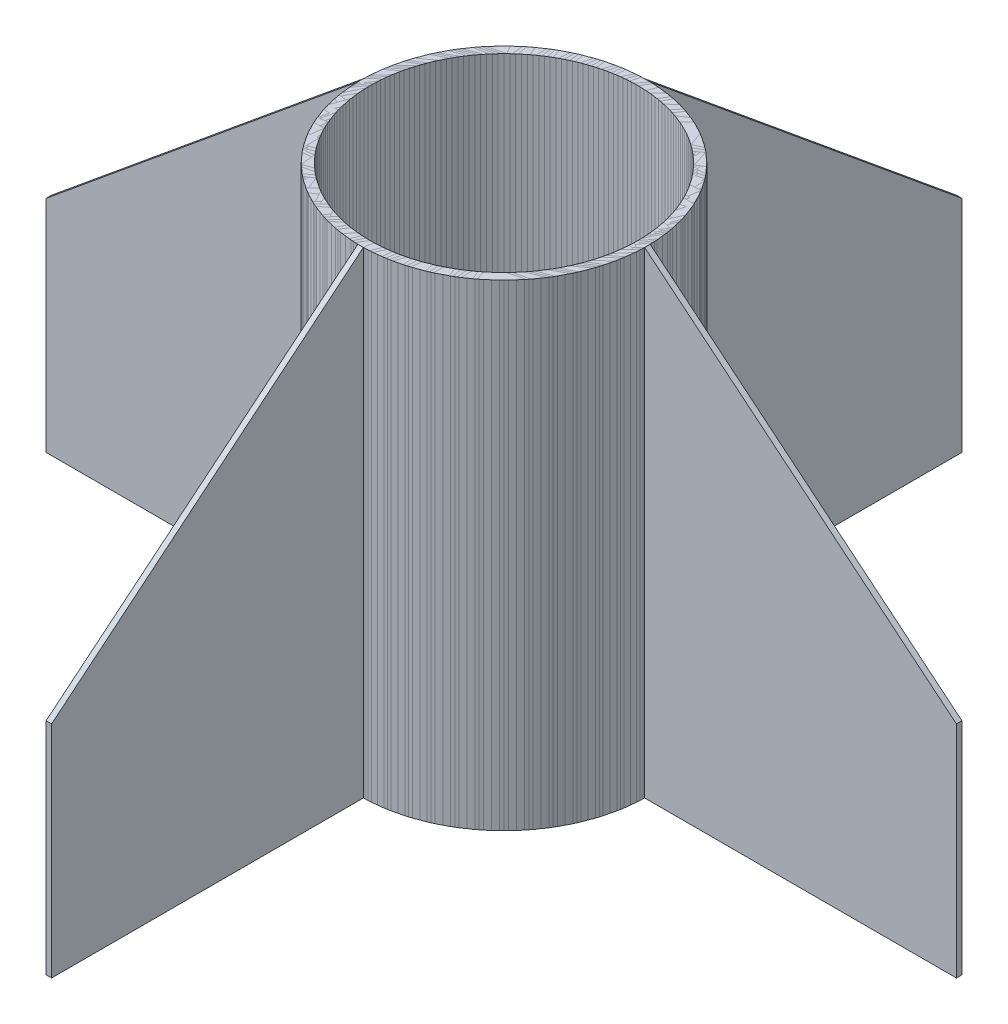
from build123d import *

# Parameters (mm, degrees)
SKETCH1_R                = 78.2
SKETCH1_R_2              = 73.2
BOSS_EXTRUDE1_DEPTH      = 260
BOSS_EXTRUDE2_DEPTH      = 1.5
BOSS_EXTRUDE2_DEPTH_BACK = 1.5
BOSS_EXTRUDE3_DEPTH      = 1.5
BOSS_EXTRUDE3_DEPTH_BACK = 1.5
SKETCH4_W                = 2
SKETCH4_H                = 260
CIRPATTERN1_COUNT        = 4


with BuildPart() as part:
    # Sketch1 → Boss-Extrude1 (new body)
    with BuildSketch(Plane(origin=(0, 0, 0), x_dir=(1, 0, 0), z_dir=(0, 1, 0))):
        Circle(SKETCH1_R)
        Circle(SKETCH1_R_2, mode=Mode.SUBTRACT)
    extrude(amount=BOSS_EXTRUDE1_DEPTH)



with BuildPart() as body_2:
    # Sketch2 → Boss-Extrude2 (new, two sides: drawn at the far end of the back side and taken through both)
    with BuildSketch(Plane.XY.offset(-BOSS_EXTRUDE2_DEPTH_BACK)):
        Polygon((78.2, 0), (78.2, 260), (248.2, 120), (248.2, 0), align=None)
    extrude(amount=BOSS_EXTRUDE2_DEPTH + BOSS_EXTRUDE2_DEPTH_BACK)


with BuildPart() as part_1:
    add(part.part)

    add(body_2.part)  # Boss-Extrude3 merges body 2
    # Sketch4 → Boss-Extrude3 (add, two sides: drawn at the far end of the back side and taken through both)
    with BuildSketch(Plane.XY.offset(-BOSS_EXTRUDE3_DEPTH_BACK)):
        with Locations((77.2, 130)):
            Rectangle(SKETCH4_W, SKETCH4_H)
    extrude(amount=BOSS_EXTRUDE3_DEPTH + BOSS_EXTRUDE3_DEPTH_BACK)


with BuildPart() as cirpattern1_1:
    # CirPattern1: pattern copy
    add(part_1.part.rotate(Axis((0, 260, 0), (0, -1, 0)), 1 * 360 / CIRPATTERN1_COUNT))


with BuildPart() as cirpattern1_2:
    # CirPattern1: pattern copy
    add(part_1.part.rotate(Axis((0, 260, 0), (0, -1, 0)), 2 * 360 / CIRPATTERN1_COUNT))


with BuildPart() as cirpattern1_3:
    # CirPattern1: pattern copy
    add(part_1.part.rotate(Axis((0, 260, 0), (0, -1, 0)), 3 * 360 / CIRPATTERN1_COUNT))


solid = Compound([part_1.part, cirpattern1_1.part, cirpattern1_2.part, cirpattern1_3.part])
